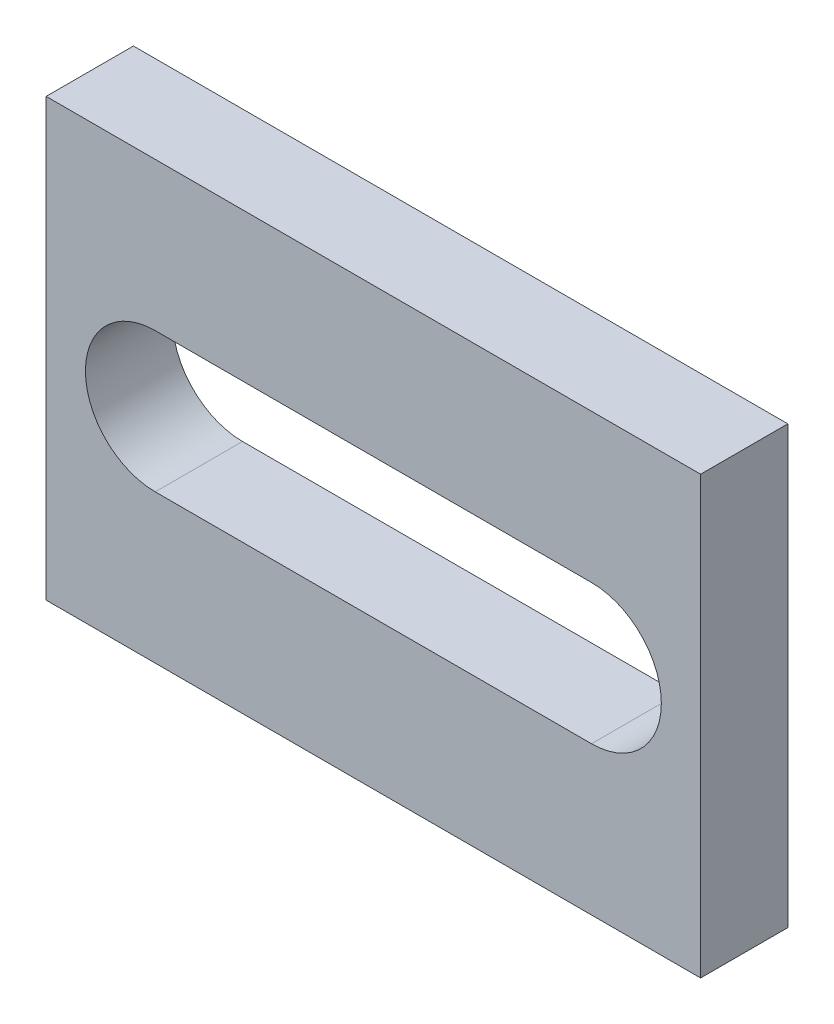
from build123d import *

# Parameters (mm, degrees)
SKETCH1_W           = 75
SKETCH1_H           = 50
BOSS_EXTRUDE1_DEPTH = 10


with BuildPart() as part:
    # Sketch1 → Boss-Extrude1 (new body)
    with BuildSketch(Plane.XY):
        with Locations((37.5, 25)):
            Rectangle(SKETCH1_W, SKETCH1_H)
        with BuildLine():
            Line((12.5, 33), (62.5, 33))
            ThreePointArc((62.5, 33), (70.5, 25), (62.5, 17))
            Line((62.5, 17), (12.5, 17))
            ThreePointArc((12.5, 17), (4.5, 25), (12.5, 33))
        make_face(mode=Mode.SUBTRACT)
    extrude(amount=BOSS_EXTRUDE1_DEPTH)


solid = part.part
